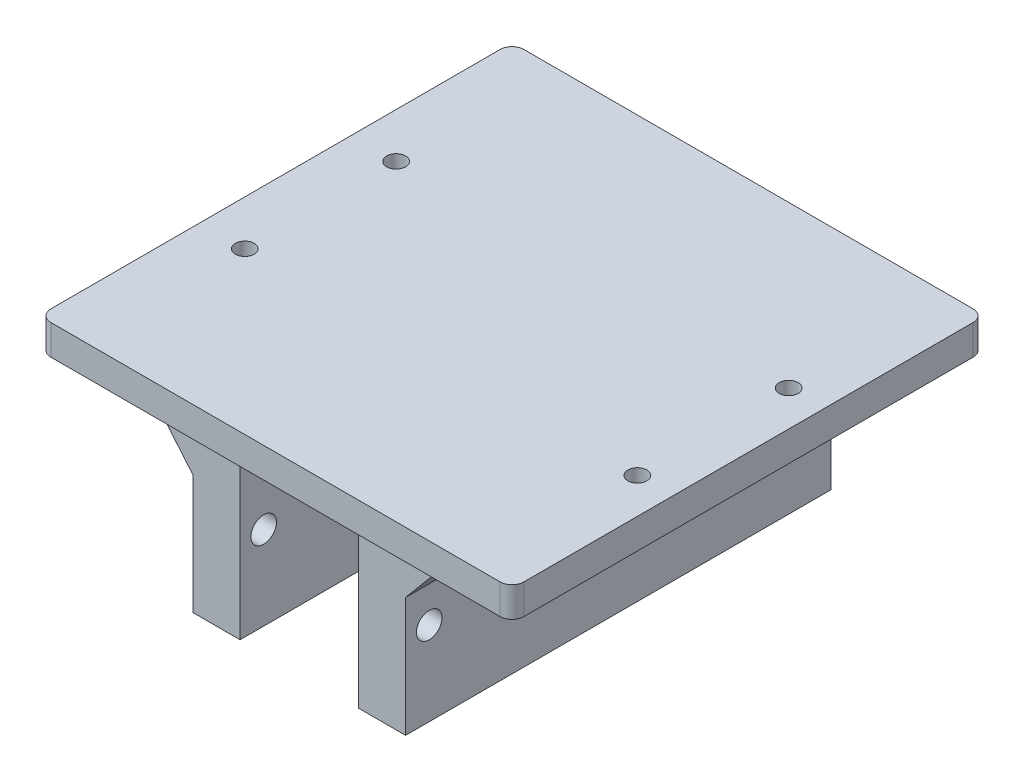
from build123d import *

# Parameters (mm, degrees)
SKETCH1_R           = 2
BOSS_EXTRUDE1_DEPTH = 6.35
SKETCH4_W           = 10
SKETCH4_H           = 90
BOSS_EXTRUDE2_DEPTH = 36.75
SKETCH5_R           = 2.7
CUT_EXTRUDE1_DEPTH  = 129.867422183
BOSS_EXTRUDE3_DEPTH = 90


with BuildPart() as part:
    # Sketch1 → Boss-Extrude1 (new body)
    with BuildSketch(Plane(origin=(0, 0, 0), x_dir=(1, 0, 0), z_dir=(0, 1, 0))):
        with BuildLine():
            Line((2.5, 0), (97.5, 0))
            ThreePointArc((97.5, 0), (99.267766953, 0.732233047), (100, 2.5))
            Line((100, 2.5), (100, 97.5))
            ThreePointArc((100, 97.5), (99.267766953, 99.267766953), (97.5, 100))
            Line((97.5, 100), (2.5, 100))
            ThreePointArc((2.5, 100), (0.732233047, 99.267766953), (0, 97.5))
            Line((0, 97.5), (0, 2.5))
            ThreePointArc((0, 2.5), (0.732233047, 0.732233047), (2.5, 0))
        make_face()
        with Locations(Location((9.5, 34, 0), (0, 0, 270))):
            Circle(SKETCH1_R, mode=Mode.SUBTRACT)
        with Locations(Location((9.5, 66, 0), (0, 0, 270))):
            Circle(SKETCH1_R, mode=Mode.SUBTRACT)
        with Locations(Location((92.5, 66, 0), (0, 0, 270))):
            Circle(SKETCH1_R, mode=Mode.SUBTRACT)
        with Locations(Location((92.5, 34, 0), (0, 0, 270))):
            Circle(SKETCH1_R, mode=Mode.SUBTRACT)
    extrude(amount=BOSS_EXTRUDE1_DEPTH)

    # Sketch4 → Boss-Extrude2 (add)
    with BuildSketch(Plane(origin=(0, 0, 0), x_dir=(1, 0, 0), z_dir=(0, 1, 0))):
        with Locations((32.5, 50)):
            Rectangle(SKETCH4_W, SKETCH4_H)
        with Locations((67.5, 50)):
            Rectangle(SKETCH4_W, SKETCH4_H)
    extrude(amount=-BOSS_EXTRUDE2_DEPTH)

    # Sketch5 → Cut-Extrude1 (cut, through all)
    with BuildSketch(Plane.ZY.offset(-27.5)):
        with Locations((-90, -19.05)):
            Circle(SKETCH5_R)
        with Locations((-50, -19.05)):
            Circle(SKETCH5_R)
        with Locations((-10, -19.05)):
            Circle(SKETCH5_R)
    extrude(amount=-CUT_EXTRUDE1_DEPTH, mode=Mode.SUBTRACT)

    # Sketch6 → Boss-Extrude3 (add)
    with BuildSketch(Plane.XY.offset(-5)):
        Polygon((72.5, 0), (82.141814145, 0), (72.5, -11.490666647), align=None)
        Polygon((27.5, 0), (17.858185855, 0), (27.5, -11.490666647), align=None)
    extrude(amount=-BOSS_EXTRUDE3_DEPTH)


solid = part.part
